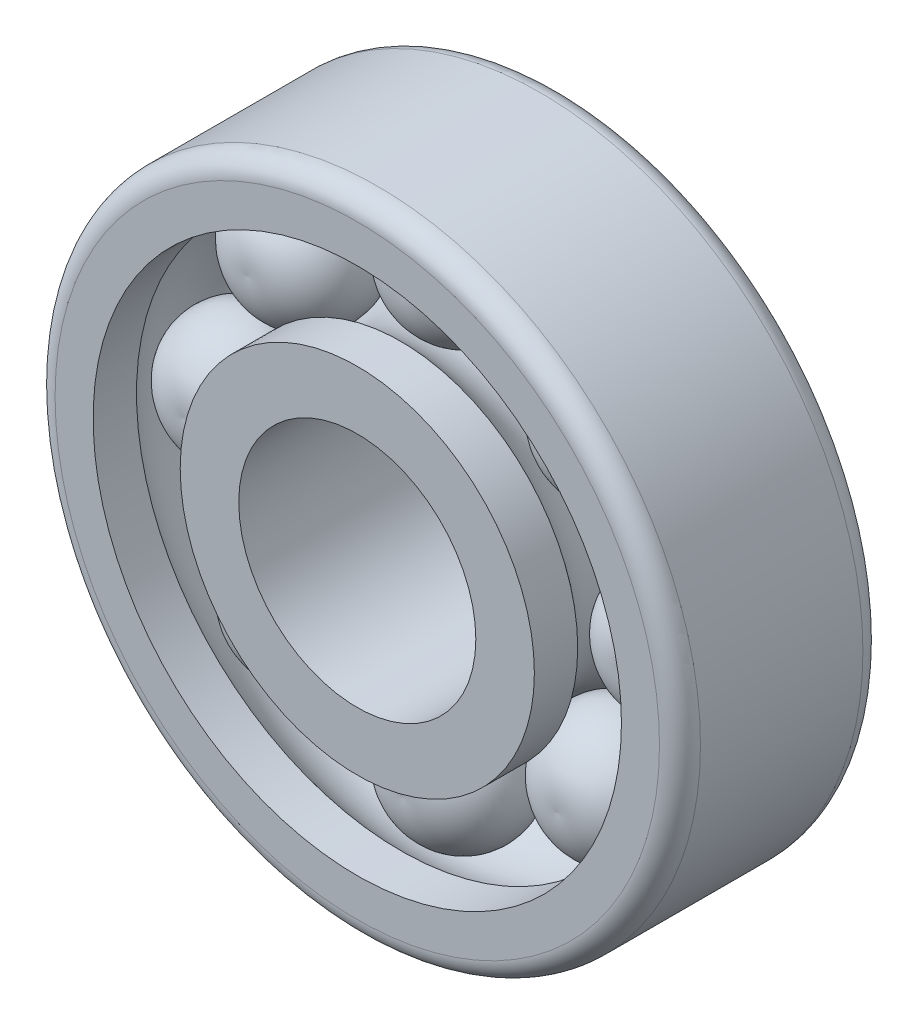
from build123d import *

# Parameters (mm, degrees)
MATRIZC4_COUNT = 8
REDONDEO1_R    = 0.7


with BuildPart() as part:
    # Croquis4 → Revolución3 (revolve)
    with BuildSketch(Plane(origin=(0, 0, 0), x_dir=(1, 0, 0), z_dir=(0, 1, 0))):
        with BuildLine():
            Line((-7.4875, 2.014873537), (-7.4875, -1.937303769))
            ThreePointArc((-7.4875, -1.937303769), (-5.245054709, 0.038784884), (-7.4875, 2.014873537))
        make_face()
    revolve(axis=Axis((-7.4875, 0, -2.014873537), (0, 0, 1)))


with BuildPart() as body_2:
    # Croquis3 → Revolución4 (revolve)
    with BuildSketch(Plane(origin=(0, 0, 0), x_dir=(1, 0, 0), z_dir=(0, 1, 0)), mode=Mode.PRIVATE) as revoluci_n4_sk:
        with BuildLine():
            Line((-9.025, 3.475), (-11.025, 3.475))
            Line((-11.025, 3.475), (-11.025, -3.475))
            Line((-11.025, -3.475), (-9.025, -3.475))
            Line((-9.025, -3.475), (-9.025, -1.993740204))
            ThreePointArc((-9.025, -1.993740204), (-10.025, 0), (-9.025, 1.993740204))
            Line((-9.025, 1.993740204), (-9.025, 3.475))
        make_face()
        with BuildLine():
            Line((-6.05, 3.475), (-4.05, 3.475))
            Line((-4.05, 3.475), (-4.05, -3.475))
            Line((-4.05, -3.475), (-6.05, -3.475))
            Line((-6.05, -3.475), (-6.05, -1.993740204))
            ThreePointArc((-6.05, -1.993740204), (-5.05, 0), (-6.05, 1.993740204))
            Line((-6.05, 1.993740204), (-6.05, 3.475))
        make_face()
    revolve(revoluci_n4_sk.sketch.rotate(Axis((0, 0, 0), (0, 0, -1)), 180), axis=Axis((0, 0, 0), (0, 0, -1)))

    # Redondeo1
    redondeo1_edges = [body_2.edges().sort_by_distance(p)[0] for p in [
        (-11.025, 0, -3.475),
        (-11.025, 0, 3.475),
    ]]
    fillet(redondeo1_edges, radius=REDONDEO1_R)


with BuildPart() as matrizc4_1:
    # MatrizC4: pattern copy
    add(part.part.rotate(Axis((0, 0, 0), (0, 0, 1)), 1 * 360 / MATRIZC4_COUNT))


with BuildPart() as matrizc4_2:
    # MatrizC4: pattern copy
    add(part.part.rotate(Axis((0, 0, 0), (0, 0, 1)), 2 * 360 / MATRIZC4_COUNT))


with BuildPart() as matrizc4_3:
    # MatrizC4: pattern copy
    add(part.part.rotate(Axis((0, 0, 0), (0, 0, 1)), 3 * 360 / MATRIZC4_COUNT))


with BuildPart() as matrizc4_4:
    # MatrizC4: pattern copy
    add(part.part.rotate(Axis((0, 0, 0), (0, 0, 1)), 4 * 360 / MATRIZC4_COUNT))


with BuildPart() as matrizc4_5:
    # MatrizC4: pattern copy
    add(part.part.rotate(Axis((0, 0, 0), (0, 0, 1)), 5 * 360 / MATRIZC4_COUNT))


with BuildPart() as matrizc4_6:
    # MatrizC4: pattern copy
    add(part.part.rotate(Axis((0, 0, 0), (0, 0, 1)), 6 * 360 / MATRIZC4_COUNT))


with BuildPart() as matrizc4_7:
    # MatrizC4: pattern copy
    add(part.part.rotate(Axis((0, 0, 0), (0, 0, 1)), 7 * 360 / MATRIZC4_COUNT))


solid = Compound([part.part, body_2.part, matrizc4_1.part, matrizc4_2.part, matrizc4_3.part, matrizc4_4.part, matrizc4_5.part, matrizc4_6.part, matrizc4_7.part])
